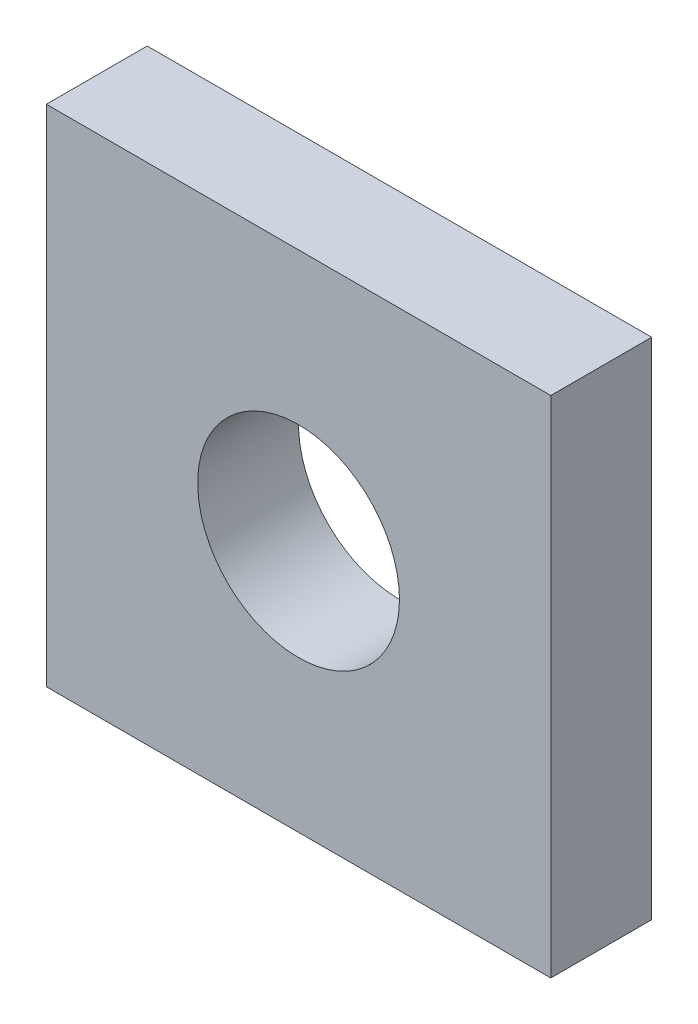
from build123d import *

# Parameters (mm, degrees)
SKETCH_1_W          = 500
SKETCH_1_H          = 500
EXTRUDE_1_DEPTH     = 100
SKETCH_2_R          = 100
CUT_EXTRUDE_1_DEPTH = 368.423461417


with BuildPart() as part:
    # 草图1 → 凸台-拉伸1 (new body)
    with BuildSketch(Plane.XY):
        Rectangle(SKETCH_1_W, SKETCH_1_H)
    extrude(amount=EXTRUDE_1_DEPTH)

    # 草图2 → 切除-拉伸1 (cut, through all)
    with BuildSketch(Plane.XY):
        Circle(SKETCH_2_R)
    extrude(amount=CUT_EXTRUDE_1_DEPTH, mode=Mode.SUBTRACT)


solid = part.part
